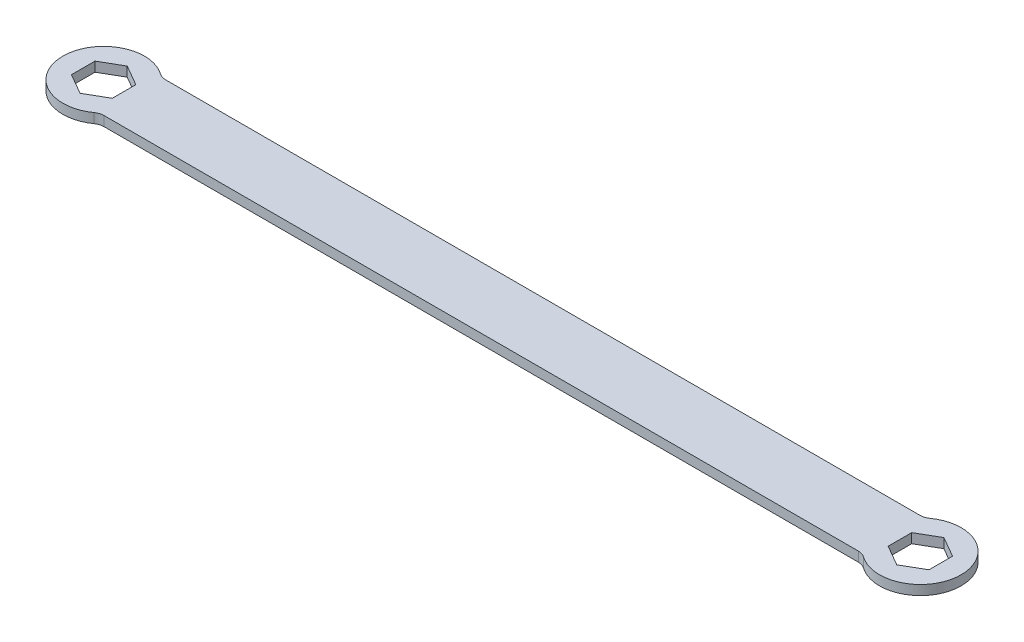
from build123d import *

# Parameters (mm, degrees)
SKETCH1_W           = 118.7
SKETCH1_H           = 9.6
BOSS_EXTRUDE1_DEPTH = 0.75
FILLET1_R           = 2


with BuildPart() as part:
    # Sketch1 → Boss-Extrude1 (new, symmetric)
    # profile 1 of 3: a face of its own
    with BuildSketch(Plane(origin=(0, 0, 0), x_dir=(1, 0, 0), z_dir=(0, 1, 0))):
        with BuildLine():
            ThreePointArc((59.35, 4.8), (69.857222631, 0), (59.35, -4.8))
            Line((59.35, -4.8), (59.35, 4.8))
        make_face()
        Polygon((60.332222631, -1.833087105), (63.507222631, -3.666174209), (66.682222631, -1.833087105), (66.682222631, 1.833087105), (63.507222631, 3.666174209), (60.332222631, 1.833087105), align=None, mode=Mode.SUBTRACT)
    # profile 2 of 3: a face of its own
    with BuildSketch(Plane(origin=(0, 0, 0), x_dir=(1, 0, 0), z_dir=(0, 1, 0))):
        Rectangle(SKETCH1_W, SKETCH1_H)
    # profile 3 of 3: a face of its own
    with BuildSketch(Plane(origin=(0, 0, 0), x_dir=(1, 0, 0), z_dir=(0, 1, 0))):
        with BuildLine():
            Line((-59.35, -4.8), (-59.35, 4.8))
            ThreePointArc((-59.35, 4.8), (-69.857222631, 0), (-59.35, -4.8))
        make_face()
        Polygon((-60.332222631, -1.833087105), (-60.332222631, 1.833087105), (-63.507222631, 3.666174209), (-66.682222631, 1.833087105), (-66.682222631, -1.833087105), (-63.507222631, -3.666174209), align=None, mode=Mode.SUBTRACT)
    extrude(amount=BOSS_EXTRUDE1_DEPTH, both=True)

    # Fillet1
    fillet1_edges = [part.edges().sort_by_distance(p)[0] for p in [
        (59.35, 0, 4.8),
        (-59.35, 0, 4.8),
        (-59.35, 0, -4.8),
        (59.35, 0, -4.8),
    ]]
    fillet(fillet1_edges, radius=FILLET1_R)


solid = part.part
